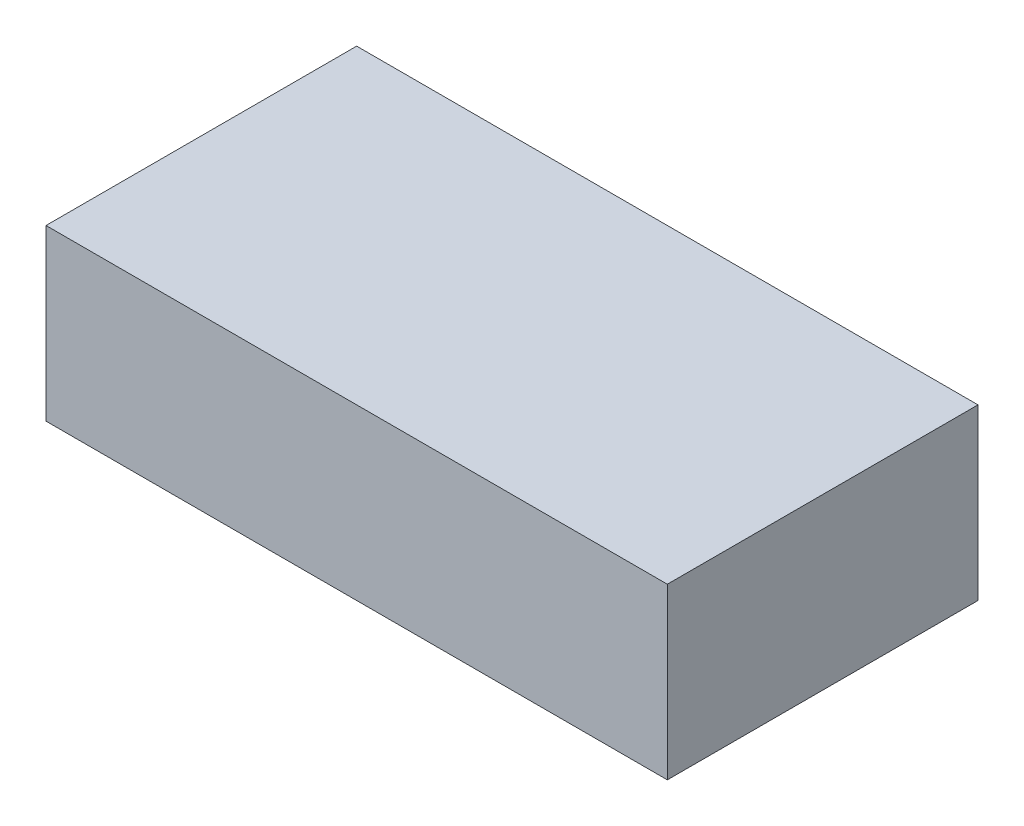
from build123d import *

# Parameters (mm, degrees)
SKETCH_1_W      = 110
SKETCH_1_H      = 55
EXTRUDE_1_DEPTH = 30


with BuildPart() as part:
    # 草图1 → 凸台-拉伸1 (new body)
    with BuildSketch(Plane(origin=(0, 0, 0), x_dir=(1, 0, 0), z_dir=(0, 1, 0))):
        Rectangle(SKETCH_1_W, SKETCH_1_H)
    extrude(amount=EXTRUDE_1_DEPTH)


solid = part.part
